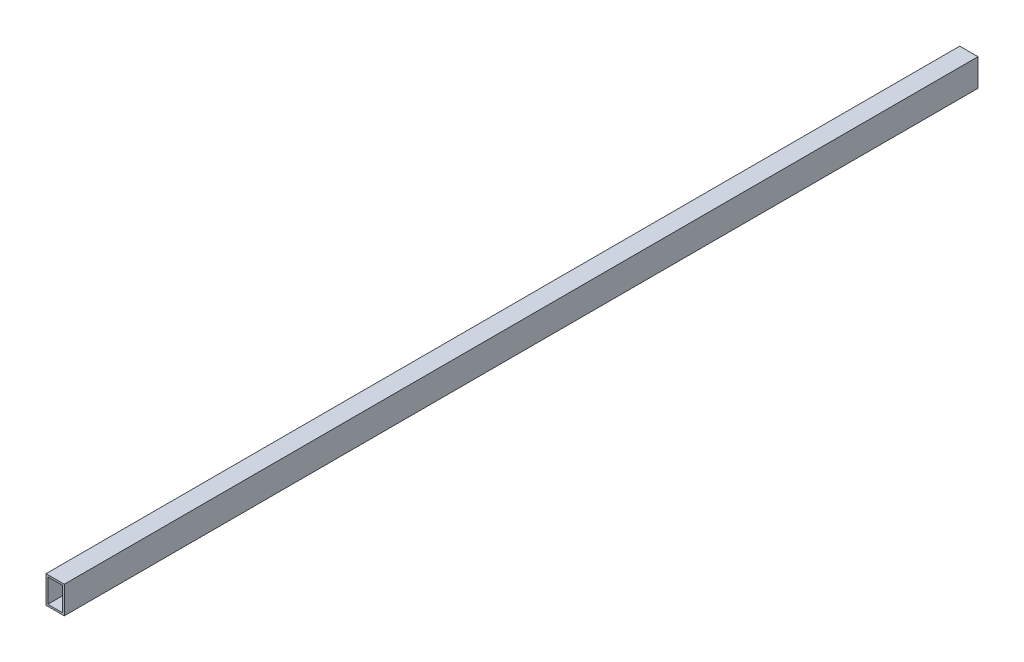
from build123d import *

# Parameters (mm, degrees)
SKETCH1_W           = 20
SKETCH1_H           = 30
SKETCH1_W_2         = 16
SKETCH1_H_2         = 26
BOSS_EXTRUDE1_DEPTH = 1000


with BuildPart() as part:
    # Sketch1 → Boss-Extrude1 (new body)
    with BuildSketch(Plane.XY):
        with Locations((11.5, 0)):
            Rectangle(SKETCH1_W, SKETCH1_H)
        with Locations((11.5, 0)):
            Rectangle(SKETCH1_W_2, SKETCH1_H_2, mode=Mode.SUBTRACT)
    extrude(amount=BOSS_EXTRUDE1_DEPTH)


solid = part.part
